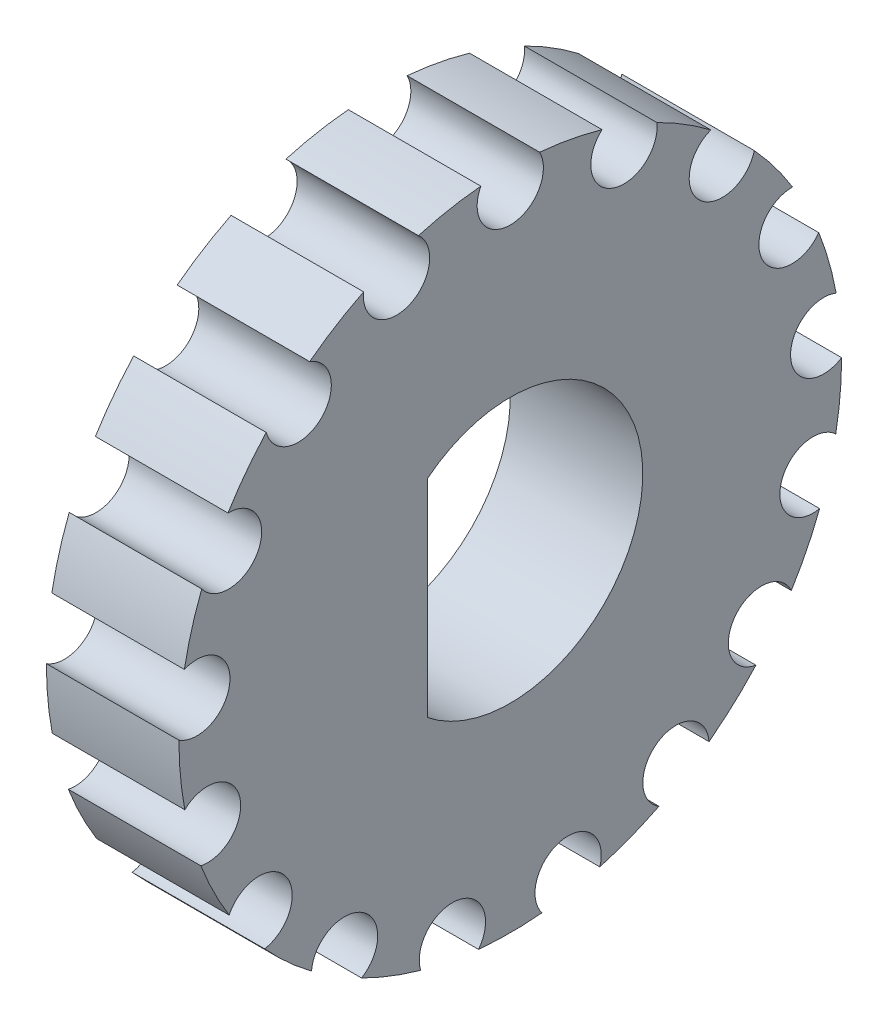
from build123d import *

# Parameters (mm, degrees)
SKETCH_1_R          = 10
EXTRUDE_2_DEPTH     = 4
SKETCH_2_R          = 1
CUT_EXTRUDE_1_DEPTH = 4
CUT_EXTRUDE_2_DEPTH = 4


with BuildPart() as part:
    # Эскиз1 → Бобышка-Вытянуть2 (new body)
    with BuildSketch(Plane(origin=(0, 0, 0), x_dir=(0, 0, -1), z_dir=(1, 0, 0))):
        Circle(SKETCH_1_R)
    extrude(amount=EXTRUDE_2_DEPTH)

    # Эскиз2 → Вырез-Вытянуть1 (cut)
    with BuildSketch(Plane.ZY):
        with Locations((0, 9.5)):
            Circle(SKETCH_2_R)
        with Locations((3.431795829, 8.858486179)):
            Circle(SKETCH_2_R)
        with Locations((6.400108615, 7.020584714)):
            Circle(SKETCH_2_R)
        with Locations((8.504051268, 4.23451438)):
            Circle(SKETCH_2_R)
        with Locations((9.459474675, 0.876549415)):
            Circle(SKETCH_2_R)
        with Locations((9.13734361, -2.599798406)):
            Circle(SKETCH_2_R)
        with Locations((7.581163659, -5.725029046)):
            Circle(SKETCH_2_R)
        with Locations((5.001105547, -8.077062789)):
            Circle(SKETCH_2_R)
        with Locations((1.745620419, -9.338244447)):
            Circle(SKETCH_2_R)
        with Locations((-1.745620419, -9.338244447)):
            Circle(SKETCH_2_R)
        with Locations((-5.001105547, -8.077062789)):
            Circle(SKETCH_2_R)
        with Locations((-7.581163659, -5.725029046)):
            Circle(SKETCH_2_R)
        with Locations((-9.13734361, -2.599798406)):
            Circle(SKETCH_2_R)
        with Locations((-9.459474675, 0.876549415)):
            Circle(SKETCH_2_R)
        with Locations((-8.504051268, 4.23451438)):
            Circle(SKETCH_2_R)
        with Locations((-6.400108615, 7.020584714)):
            Circle(SKETCH_2_R)
        with Locations((-3.431795829, 8.858486179)):
            Circle(SKETCH_2_R)
    extrude(amount=-CUT_EXTRUDE_1_DEPTH, mode=Mode.SUBTRACT)

    # Эскиз3 → Вырез-Вытянуть2 (cut)
    with BuildSketch(Plane(origin=(4, 0, 0), x_dir=(0, 0, -1), z_dir=(1, 0, 0))):
        with BuildLine():
            Line((-2.5, 3.122498999), (-2.5, -3.122498999))
            ThreePointArc((-2.5, -3.122498999), (4, 0), (-2.5, 3.122498999))
        make_face()
    extrude(amount=-CUT_EXTRUDE_2_DEPTH, mode=Mode.SUBTRACT)


solid = part.part
